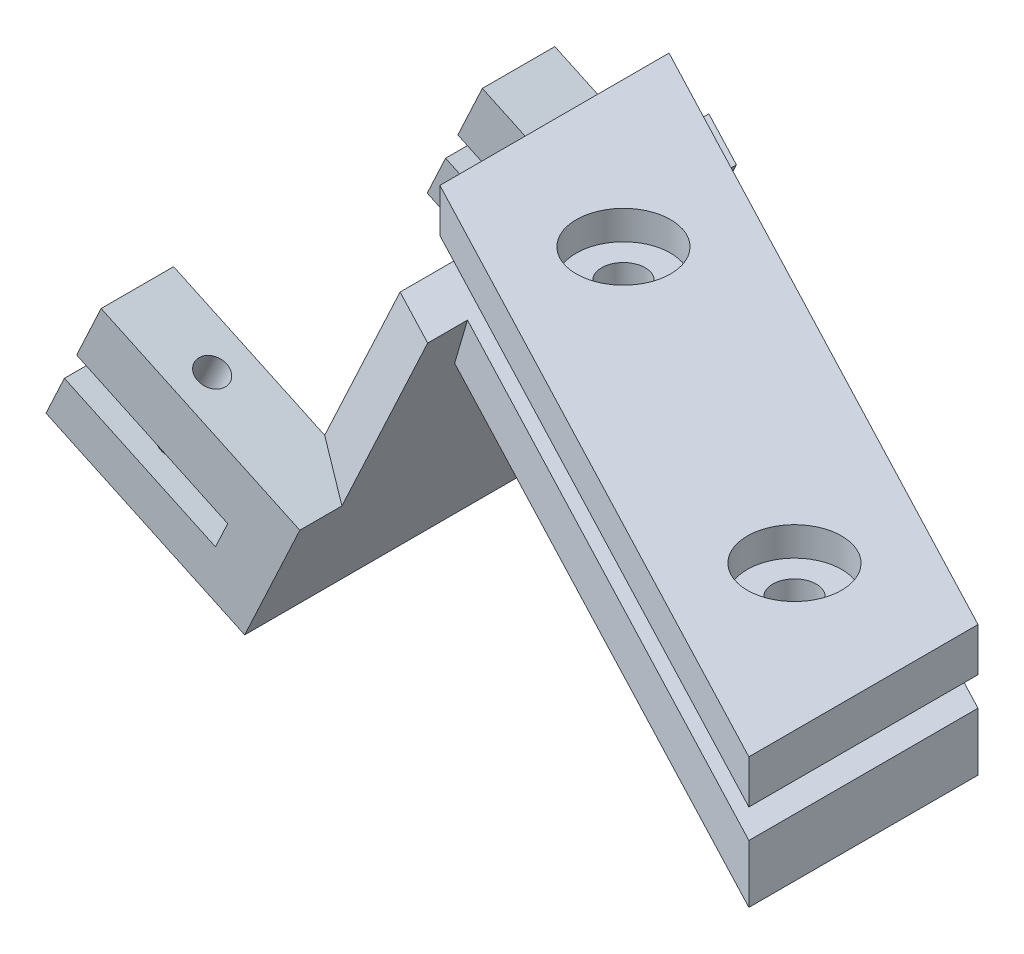
from build123d import *

# Parameters (mm, degrees)
BOSS_EXTRUDE1_DEPTH     = 3
SKETCH1_R               = 6
BOSS_EXTRUDE3_DEPTH     = 2
SKETCH4_R               = 1.5
CUT_EXTRUDE1_DEPTH      = 44.812962497
SKETCH5_R               = 3.25
CUT_EXTRUDE2_DEPTH      = 2
SKETCH6_R               = 1.5
BOSS_EXTRUDE4_DEPTH     = 4
CUT_EXTRUDE3_DEPTH      = 48.222467532
CUT_EXTRUDE3_DEPTH_BACK = 48.222467532
SKETCH9_W               = 15.125231148
SKETCH9_H               = 5
SKETCH9_R               = 1
BOSS_EXTRUDE6_DEPTH     = 4
SKETCH10_W              = 3.625231148
SKETCH10_H              = 31.3
BOSS_EXTRUDE7_DEPTH     = 2
SKETCH11_R              = 1
BOSS_EXTRUDE8_DEPTH     = 3


with BuildPart() as part:
    # Sketch3 → Boss-Extrude1 (new body)
    with BuildSketch(Plane(origin=(0, 0, 0), x_dir=(1, 0, 0), z_dir=(0, 1, 0))):
        Polygon((-10, 13.145588768), (-10, -2.661376867), (34.799193535, -26.145588768), (34.799193535, -10.338623133), align=None)
    extrude(amount=BOSS_EXTRUDE1_DEPTH)

    # Sketch1 → Boss-Extrude3 (add)
    with BuildSketch(Plane(origin=(0, 0, 0), x_dir=(1, 0, 0), z_dir=(0, 1, 0))):
        with Locations(Location((0, 0, 0), (0, 0, 270))):
            Circle(SKETCH1_R)
        with Locations(Location((24.799193535, -13, 0), (0, 0, 270))):
            Circle(SKETCH1_R)
    extrude(amount=-BOSS_EXTRUDE3_DEPTH)

    # Sketch4 → Cut-Extrude1 (cut, through all)
    with BuildSketch(Plane(origin=(0, 3, 0), x_dir=(1, 0, 0), z_dir=(0, 1, 0))):
        with Locations(Location((0, 0, 0), (0, 0, 270))):
            Circle(SKETCH4_R)
        with Locations(Location((24.799193535, -13, 0), (0, 0, 270))):
            Circle(SKETCH4_R)
    extrude(amount=-CUT_EXTRUDE1_DEPTH, mode=Mode.SUBTRACT)

    # Sketch5 → Cut-Extrude2 (cut)
    with BuildSketch(Plane(origin=(0, 3, 0), x_dir=(1, 0, 0), z_dir=(0, 1, 0))):
        with Locations(Location((0, 0, 0), (0, 0, 270))):
            Circle(SKETCH5_R)
        with Locations(Location((24.799193535, -13, 0), (0, 0, 270))):
            Circle(SKETCH5_R)
    extrude(amount=-CUT_EXTRUDE2_DEPTH, mode=Mode.SUBTRACT)


with BuildPart() as body_2:
    # Sketch6 → Boss-Extrude4 (new body)
    with BuildSketch(Plane.XZ.offset(2)):
        Polygon((-10, 2.661376867), (-10, -13.145588768), (34.799193535, 10.338623133), (34.799193535, 26.145588768), align=None)
        with Locations(Location((0, 0, 0), (0, 0, 270))):
            Circle(SKETCH6_R, mode=Mode.SUBTRACT)
        with Locations(Location((24.799193535, 13, 0), (0, 0, 270))):
            Circle(SKETCH6_R, mode=Mode.SUBTRACT)
    extrude(amount=BOSS_EXTRUDE4_DEPTH)

    # Sketch16 → Loft1 section 0
    with BuildSketch(Plane(origin=(0, -18.313540167, 0), x_dir=(-1, 0, 0), z_dir=(0, -1, 0))):
        with BuildLine():
            Line((13.607128711, -7.50473643), (13.607128711, 13.79526357))
            Line((13.607128711, 13.79526357), (17.607128711, 15.892105951))
            Line((17.607128711, 15.892105951), (17.607128711, -5.407894049))
            Line((17.607128711, -5.407894049), (13.607128711, -7.50473643))
        make_face()
    # Sketch7 → Loft1 section 1
    with BuildSketch(Plane(origin=(0, -2, 0), x_dir=(1, 0, 0), z_dir=(0, 1, 0))):
        with BuildLine():
            Line((-10, 15.892105951), (-10, -5.407894049))
            Line((-10, -5.407894049), (-6, -7.50473643))
            Line((-6, -7.50473643), (-6, 13.79526357))
            Line((-6, 13.79526357), (-10, 15.892105951))
        make_face()
    loft()

    # Sketch17 → Cut-Extrude3 (cut, two sides: drawn at the far end of the back side and taken through both)
    with BuildSketch(Plane.XY.offset(-CUT_EXTRUDE3_DEPTH_BACK)):
        Polygon((-17.607128711, -18.313540167), (-13.607128711, -18.313540167), (-16.892703931, -16.78145128), align=None)
    extrude(amount=CUT_EXTRUDE3_DEPTH + CUT_EXTRUDE3_DEPTH_BACK, mode=Mode.SUBTRACT)

    # Sketch9 → Boss-Extrude6 (add)
    # profile 1 of 2: a face of its own
    with BuildSketch(Plane(origin=(-26.705419865, -12.205706693, 0), x_dir=(-0.9063077870366525, 0.42261826174069417, 0), z_dir=(0.4226182617406941, 0.9063077870366524, 0))):
        with Locations((-6.889749661, 7.907894049)):
            Rectangle(SKETCH9_W, SKETCH9_H)
        with Locations(Location((-5.077134087, 7.957894049, 0), (0, 0, 180))):
            Circle(SKETCH9_R, mode=Mode.SUBTRACT)
    # profile 2 of 2: a face of its own
    with BuildSketch(Plane(origin=(-26.705419865, -12.205706693, 0), x_dir=(-0.9063077870366525, 0.42261826174069417, 0), z_dir=(0.4226182617406941, 0.9063077870366524, 0))):
        Polygon((-10.827134087, -15.892105951), (0.672865913, -15.892105951), (0.672865913, -20.892105951), (-14.452365235, -20.892105951), (-14.452365235, -15.892105951), (-14.452365235, -13.79526357), align=None)
        with Locations(Location((-5.077134087, -18.442105951, 0), (0, 0, 180))):
            Circle(SKETCH9_R, mode=Mode.SUBTRACT)
    extrude(amount=BOSS_EXTRUDE6_DEPTH)

    # Sketch10 → Boss-Extrude7 (add)
    with BuildSketch(Plane(origin=(-50.114461272, -1.289891415, 0), x_dir=(-0.9063077870366525, 0.42261826174069417, 0), z_dir=(0.4226182617406941, 0.9063077870366524, 0))):
        with Locations((-38.468769054, -5.242105951)):
            Rectangle(SKETCH10_W, SKETCH10_H)
    extrude(amount=-BOSS_EXTRUDE7_DEPTH)

    # Sketch11 → Boss-Extrude8 (add)
    with BuildSketch(Plane(origin=(-10.290046849, -22.06707668, 0), x_dir=(0.9063077870366528, -0.4226182617406936, 0), z_dir=(-0.4226182617406936, -0.9063077870366528, 0))):
        Polygon((-19.717841347, 10.407894049), (-4.592610199, 10.407894049), (-4.592610199, -20.892105951), (-19.717841347, -20.892105951), (-19.717841347, -15.892105951), (-8.217841347, -15.892105951), (-8.217841347, 5.407894049), (-19.717841347, 5.407894049), align=None)
        with Locations((-13.967841347, -18.442105951)):
            Circle(SKETCH11_R, mode=Mode.SUBTRACT)
        with Locations((-13.967841347, 7.957894049)):
            Circle(SKETCH11_R, mode=Mode.SUBTRACT)
    extrude(amount=BOSS_EXTRUDE8_DEPTH)


solid = Compound([part.part, body_2.part])
